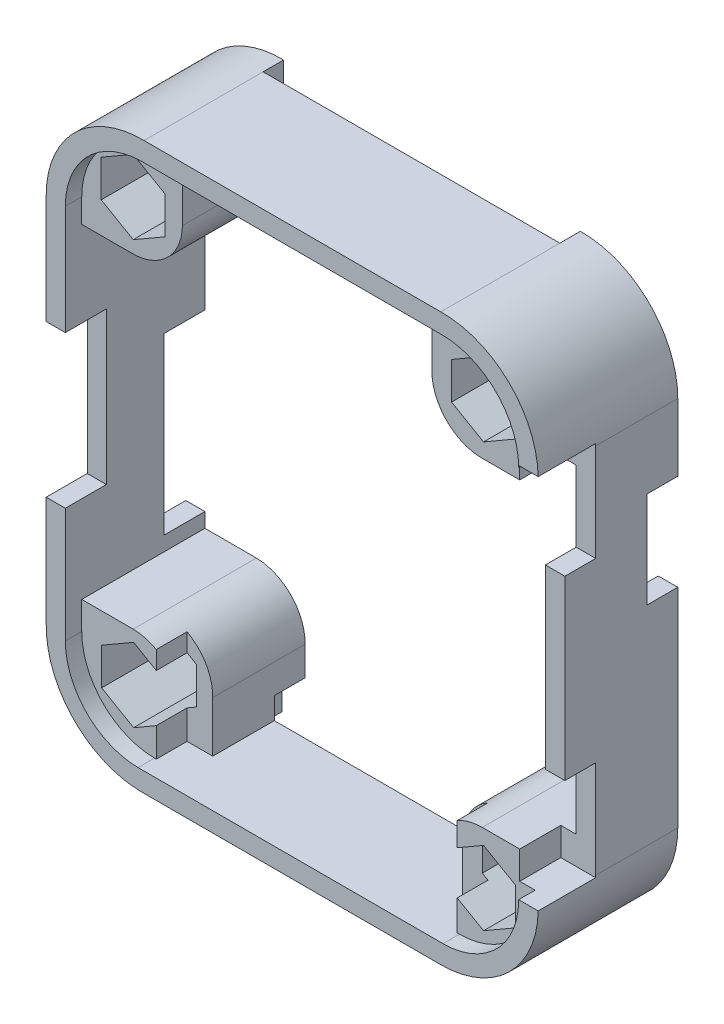
from build123d import *

# Parameters (mm, degrees)
EXTRUDE_1_DEPTH      = 12
EXTRUDE_2_DEPTH      = 12
EXTRUDE_2_2_DEPTH    = 12
EXTRUDE_2_3_DEPTH    = 12
EXTRUDE_3_DEPTH      = 13.6
MODEL_6_W            = 1.861117915
MODEL_6_H            = 16.51
CUT_EXTRUDE_1_DEPTH  = 4
MODEL_7_W            = 1.861117915
MODEL_7_H            = 14.818640087
EXTRUDE_5_DEPTH      = 16
MODEL_8_W            = 1.861117915
MODEL_8_H            = 9.9314
CUT_EXTRUDE_2_DEPTH  = 4
SKETCH_3_W           = 1.861117915
SKETCH_3_H           = 14.818640087
CUT_EXTRUDE_3_DEPTH  = 6.4
MODEL_11_W           = 1.901436907
MODEL_11_H           = 36.247223099
EXTRUDE_6_DEPTH      = 16
MODEL_12_W           = 1.901436907
MODEL_12_H           = 9.766004581
CUT_EXTRUDE_5_DEPTH  = 3
SKETCH_4_W           = 1.901436907
SKETCH_4_H           = 36.247223099
CUT_EXTRUDE_6_DEPTH  = 8
SKETCH_5_W           = 4
SKETCH_5_H           = 2.578317469
CUT_EXTRUDE_8_DEPTH  = 1.5
SKETCH_6_W           = 4
SKETCH_6_H           = 2.52224752
CUT_EXTRUDE_9_DEPTH  = 1.5
SKETCH_7_W           = 1.901436907
SKETCH_7_H           = 17.247223099
EXTRUDE_7_DEPTH      = 3
SKETCH_11_W          = 29.089002021
SKETCH_11_H          = 3
CUT_EXTRUDE_15_DEPTH = 4
SKETCH_12_W          = 28.91701862
SKETCH_12_H          = 2
CUT_EXTRUDE_16_DEPTH = 3
SKETCH_13_W          = 1
SKETCH_13_H          = 10.956361678
CUT_EXTRUDE_17_DEPTH = 3
SKETCH_14_W          = 1
SKETCH_14_H          = 13.350607955
CUT_EXTRUDE_19_DEPTH = 3
SKETCH_16_W          = 1
SKETCH_16_H          = 8.807709457
CUT_EXTRUDE_23_DEPTH = 2
SKETCH_17_W          = 1
SKETCH_17_H          = 9.756796511
CUT_EXTRUDE_24_DEPTH = 2
SKETCH_18_W          = 3
SKETCH_18_H          = 0.152653388
CUT_EXTRUDE_25_DEPTH = 1
SKETCH_20_W          = 3
SKETCH_20_H          = 10.821193865
CUT_EXTRUDE_27_DEPTH = 1
SKETCH_21_W          = 3
SKETCH_21_H          = 10.837379137
CUT_EXTRUDE_28_DEPTH = 1
SKETCH_21_2_W        = 3
SKETCH_21_2_H        = 10.837379137
CUT_EXTRUDE_29_DEPTH = 1.5
SKETCH_20_2_W        = 3
SKETCH_20_2_H        = 10.821193865
CUT_EXTRUDE_30_DEPTH = 1.5
SKETCH_22_W          = 1.861117915
SKETCH_22_H          = 4
CUT_EXTRUDE_31_DEPTH = 0.5
CUT_EXTRUDE_32_DEPTH = 0.2
CUT_EXTRUDE_33_DEPTH = 0.2
SKETCH_25_W          = 1.901436907
SKETCH_25_H          = 3
EXTRUDE_8_DEPTH      = 0.2
SKETCH_26_W          = 1.901436907
SKETCH_26_H          = 3
EXTRUDE_9_DEPTH      = 0.2


with BuildPart() as part:
    # Model → 凸台-拉伸1 (new body)
    with BuildSketch(Plane.XY):
        with BuildLine():
            Line((-5.056766423, 38.678641935), (-5.056766423, 36.349648899))
            Line((-5.056766423, 36.349648899), (-0.212608944, 36.349648899))
            ThreePointArc((-0.212608944, 36.349648899), (3.272838734, 37.712970368), (4.757065456, 41.148674369))
            Line((4.757065456, 41.148674369), (4.757065456, 46.178639116))
            Line((4.757065456, 46.178639116), (3.757607617, 46.178639116))
            Line((3.757607617, 46.178639116), (2.443231277, 46.178639116))
            ThreePointArc((2.443231277, 46.178639116), (-2.860067772, 43.981940832), (-5.056766423, 38.678641935))
        make_face()
        Polygon((-3.15877702, 42.96368598), (-0.0410845, 44.76368746), (3.07660802, 42.96368598), (3.07660802, 39.3636881), (-0.0410845, 37.56368662), (-3.15877702, 39.3636881), align=None, mode=Mode.SUBTRACT)
    extrude(amount=EXTRUDE_1_DEPTH)



with BuildPart() as body_2:
    # Model<3> → 凸台-拉伸2 (new body)
    with BuildSketch(Plane.XY):
        with BuildLine():
            Line((29.027268179, 0.031482865), (29.027268179, -5.15195259))
            Line((29.027268179, -5.15195259), (31.741581646, -5.15195259))
            ThreePointArc((31.741581646, -5.15195259), (36.960901493, -2.990035293), (39.122812995, 2.229286954))
            Line((39.122812995, 2.229286954), (39.122812995, 4.969335617))
            Line((39.122812995, 4.969335617), (33.969415054, 4.969335617))
            ThreePointArc((33.969415054, 4.969335617), (30.475678827, 3.523961372), (29.027268179, 0.031482865))
        make_face()
        Polygon((34.09651804, -3.68591338), (30.97882298, -1.8859119), (30.97882298, 1.71408598), (34.0965155, 3.51408746), (37.21420802, 1.71408598), (37.21420802, -1.8859119), align=None, mode=Mode.SUBTRACT)
    extrude(amount=EXTRUDE_2_DEPTH)


with BuildPart() as body_3:
    # Model<3> → Extrude 2 2 (new body)
    with BuildSketch(Plane.XY):
        with BuildLine():
            Line((2.033632482, -5.15195259), (4.708551083, -5.15195259))
            Line((4.708551083, -5.15195259), (4.708551083, -0.206170722))
            ThreePointArc((4.708551083, -0.206170722), (3.349197601, 3.228253817), (-0.040514857, 4.695551758))
            Line((-0.040514857, 4.695551758), (-5.056766423, 4.695551758))
            Line((-5.056766423, 4.695551758), (-5.056766423, 1.985776523))
            ThreePointArc((-5.056766423, 1.985776523), (-2.982889473, -3.044654212), (2.033632482, -5.15195259))
        make_face()
        Polygon((2.54e-06, -3.60000042), (-3.11769252, -1.7999964), (-3.11769252, 1.80000148), (0, 3.60000042), (3.11769252, 1.79999894), (3.11769252, -1.79999894), align=None, mode=Mode.SUBTRACT)
    extrude(amount=EXTRUDE_2_2_DEPTH)


with BuildPart() as body_4:
    # Model<3> → Extrude 2 3 (new body)
    with BuildSketch(Plane.XY):
        with BuildLine():
            Line((34.06287636, 36.115993727), (39.122812995, 36.115993727))
            Line((39.122812995, 36.115993727), (39.122812995, 38.694311196))
            ThreePointArc((39.122812995, 38.694311196), (36.915047022, 43.993015596), (31.607170917, 46.178639116))
            Line((31.607170917, 46.178639116), (29.06336134, 46.178639116))
            Line((29.06336134, 46.178639116), (29.06336134, 41.019064947))
            ThreePointArc((29.06336134, 41.019064947), (30.533645299, 37.517805959), (34.06287636, 36.115993727))
        make_face()
        Polygon((34.0965155, 37.56368662), (30.97882298, 39.3636881), (30.97882298, 42.96368598), (34.0965155, 44.76368746), (37.21420802, 42.96368598), (37.21420802, 39.3636881), align=None, mode=Mode.SUBTRACT)
    extrude(amount=EXTRUDE_2_3_DEPTH)


with BuildPart() as part_1:
    add(part.part)

    add(body_2.part)  # 凸台-拉伸3 merges body 2

    add(body_3.part)  # 凸台-拉伸3 merges body 3

    add(body_4.part)  # 凸台-拉伸3 merges body 4
    # Model<4> → 凸台-拉伸3 (add)
    with BuildSketch(Plane.XY):
        with BuildLine():
            ThreePointArc((31.538111903, -7.038912743), (38.245775916, -4.260535743), (41.024249902, 2.447088097))
            Line((41.024249902, 2.447088097), (41.024249902, 38.694311196))
            ThreePointArc((41.024249902, 38.694311196), (38.234155861, 45.358917184), (31.531111662, 48.055358577))
            Line((31.531111662, 48.055358577), (30.12859608, 48.055358577))
            Line((30.12859608, 48.055358577), (2.614093042, 48.055358577))
            ThreePointArc((2.614093042, 48.055358577), (-4.112474971, 45.375188878), (-6.917884338, 38.699883257))
            Line((-6.917884338, 38.699883257), (-6.917884338, 2.454230577))
            ThreePointArc((-6.917884338, 2.454230577), (-4.219356196, -4.250932902), (2.449109882, -7.038912743))
            Line((2.449109882, -7.038912743), (31.538111903, -7.038912743))
        make_face()
        with BuildLine():
            ThreePointArc((2.033632482, -5.15195259), (-2.982889473, -3.044654212), (-5.056766423, 1.985776523))
            Line((-5.056766423, 1.985776523), (-5.056766423, 38.678641935))
            ThreePointArc((-5.056766423, 38.678641935), (-2.860067772, 43.981940832), (2.443231277, 46.178639116))
            Line((2.443231277, 46.178639116), (31.607170917, 46.178639116))
            ThreePointArc((31.607170917, 46.178639116), (36.915047022, 43.993015596), (39.122812995, 38.694311196))
            Line((39.122812995, 38.694311196), (39.122812995, 2.229286954))
            ThreePointArc((39.122812995, 2.229286954), (36.960901493, -2.990035293), (31.741581646, -5.15195259))
            Line((31.741581646, -5.15195259), (2.033632482, -5.15195259))
        make_face(mode=Mode.SUBTRACT)
    extrude(amount=EXTRUDE_3_DEPTH)

    # Model<6> → 切除-拉伸1 (cut)
    with BuildSketch(Plane.XY):
        with Locations((-5.98732538, 14.8676868)):
            Rectangle(MODEL_6_W, MODEL_6_H)
    extrude(amount=CUT_EXTRUDE_1_DEPTH, mode=Mode.SUBTRACT)

    # Model<7> → 凸台-拉伸5 (add)
    with BuildSketch(Plane.XY):
        with Locations((-5.98732538, 20.600606844)):
            Rectangle(MODEL_7_W, MODEL_7_H)
    extrude(amount=EXTRUDE_5_DEPTH)

    # Model<8> → 切除-拉伸2 (cut)
    with BuildSketch(Plane.XY):
        with Locations((-5.98732538, 18.1569868)):
            Rectangle(MODEL_8_W, MODEL_8_H)
    extrude(amount=CUT_EXTRUDE_2_DEPTH, mode=Mode.SUBTRACT)

    # 草图3 → 切除-拉伸3 (cut)
    with BuildSketch(Plane.XY.offset(16)):
        with Locations((-5.98732538, 20.600606844)):
            Rectangle(SKETCH_3_W, SKETCH_3_H)
    extrude(amount=-CUT_EXTRUDE_3_DEPTH, mode=Mode.SUBTRACT)

    # Model<11> → 凸台-拉伸6 (add)
    with BuildSketch(Plane.XY):
        with Locations((40.073531449, 20.570699646)):
            Rectangle(MODEL_11_W, MODEL_11_H)
    extrude(amount=EXTRUDE_6_DEPTH)

    # Model<12> → 切除-拉伸5 (cut)
    with BuildSketch(Plane.XY):
        with Locations((40.073531449, 27.445079549)):
            Rectangle(MODEL_12_W, MODEL_12_H)
    extrude(amount=CUT_EXTRUDE_5_DEPTH, mode=Mode.SUBTRACT)

    # 草图4 → 切除-拉伸6 (cut)
    with BuildSketch(Plane.XY.offset(16)):
        with Locations((40.073531449, 20.570699646)):
            Rectangle(SKETCH_4_W, SKETCH_4_H)
    extrude(amount=-CUT_EXTRUDE_6_DEPTH, mode=Mode.SUBTRACT)

    # 草图5 → 切除-拉伸8 (cut)
    with BuildSketch(Plane(origin=(39.122812995, 0, 0), x_dir=(0, 0, -1), z_dir=(1, 0, 0))):
        with Locations((-10, 37.405152462)):
            Rectangle(SKETCH_5_W, SKETCH_5_H)
    extrude(amount=-CUT_EXTRUDE_8_DEPTH, mode=Mode.SUBTRACT)

    # 草图6 → 切除-拉伸9 (cut)
    with BuildSketch(Plane(origin=(39.122812995, 0, 0), x_dir=(0, 0, -1), z_dir=(1, 0, 0))):
        with Locations((-10, 3.708211857)):
            Rectangle(SKETCH_6_W, SKETCH_6_H)
    extrude(amount=-CUT_EXTRUDE_9_DEPTH, mode=Mode.SUBTRACT)

    # 草图7 → 凸台-拉伸7 (add)
    with BuildSketch(Plane.XY.offset(8)):
        with Locations((40.073531449, 20.570699646)):
            Rectangle(SKETCH_7_W, SKETCH_7_H)
    extrude(amount=EXTRUDE_7_DEPTH)

    # 草图11 → 切除-拉伸15 (cut)
    with BuildSketch(Plane(origin=(0, -7.038912743, 0), x_dir=(-1, 0, 0), z_dir=(0, -1, 0))):
        with Locations((-16.993610893, -1.5)):
            Rectangle(SKETCH_11_W, SKETCH_11_H)
    extrude(amount=-CUT_EXTRUDE_15_DEPTH, mode=Mode.SUBTRACT)

    # 草图12 → 切除-拉伸16 (cut)
    with BuildSketch(Plane(origin=(0, 48.055358577, 0), x_dir=(1, 0, 0), z_dir=(0, 1, 0))):
        with Locations((17.072602352, -1)):
            Rectangle(SKETCH_12_W, SKETCH_12_H)
    extrude(amount=-CUT_EXTRUDE_16_DEPTH, mode=Mode.SUBTRACT)

    # 草图13 → 切除-拉伸17 (cut)
    with BuildSketch(Plane.XY.offset(12)):
        with Locations((4.208551083, 0.326228249)):
            Rectangle(SKETCH_13_W, SKETCH_13_H)
    extrude(amount=-CUT_EXTRUDE_17_DEPTH, mode=Mode.SUBTRACT)

    # 草图14 → 切除-拉伸19 (cut)
    with BuildSketch(Plane.XY.offset(12)):
        with Locations((29.527268179, 1.523351387)):
            Rectangle(SKETCH_14_W, SKETCH_14_H)
    extrude(amount=-CUT_EXTRUDE_19_DEPTH, mode=Mode.SUBTRACT)

    # 草图16 → 切除-拉伸23 (cut)
    with BuildSketch(Plane(origin=(0, 0, 0), x_dir=(-1, 0, 0), z_dir=(0, 0, -1))):
        with Locations((-29.56336134, 40.651503848)):
            Rectangle(SKETCH_16_W, SKETCH_16_H)
    extrude(amount=-CUT_EXTRUDE_23_DEPTH, mode=Mode.SUBTRACT)

    # 草图17 → 切除-拉伸24 (cut)
    with BuildSketch(Plane(origin=(0, 0, 0), x_dir=(-1, 0, 0), z_dir=(0, 0, -1))):
        with Locations((-4.257065456, 40.176960322)):
            Rectangle(SKETCH_17_W, SKETCH_17_H)
    extrude(amount=-CUT_EXTRUDE_24_DEPTH, mode=Mode.SUBTRACT)

    # 草图18 → 切除-拉伸25 (cut)
    with BuildSketch(Plane.ZY.offset(-4.708551083)):
        with Locations((10.5, -0.129844028)):
            Rectangle(SKETCH_18_W, SKETCH_18_H)
    extrude(amount=-CUT_EXTRUDE_25_DEPTH, mode=Mode.SUBTRACT)

    # 草图20 → 切除-拉伸27 (cut)
    with BuildSketch(Plane.ZY.offset(-30.027268179)):
        with Locations((10.5, 0.258644342)):
            Rectangle(SKETCH_20_W, SKETCH_20_H)
    extrude(amount=-CUT_EXTRUDE_27_DEPTH, mode=Mode.SUBTRACT)

    # 草图21 → 切除-拉伸28 (cut)
    with BuildSketch(Plane(origin=(3.708551083, 0, 0), x_dir=(0, 0, -1), z_dir=(1, 0, 0))):
        with Locations((-10.5, 0.266736978)):
            Rectangle(SKETCH_21_W, SKETCH_21_H)
    extrude(amount=-CUT_EXTRUDE_28_DEPTH, mode=Mode.SUBTRACT)

    # 草图21<2> → 切除-拉伸29 (cut)
    with BuildSketch(Plane(origin=(3.708551083, 0, 0), x_dir=(0, 0, -1), z_dir=(1, 0, 0))):
        with Locations((-10.5, 0.266736978)):
            Rectangle(SKETCH_21_2_W, SKETCH_21_2_H)
    extrude(amount=-CUT_EXTRUDE_29_DEPTH, mode=Mode.SUBTRACT)

    # 草图20<2> → 切除-拉伸30 (cut)
    with BuildSketch(Plane.ZY.offset(-30.027268179)):
        with Locations((10.5, 0.258644342)):
            Rectangle(SKETCH_20_2_W, SKETCH_20_2_H)
    extrude(amount=-CUT_EXTRUDE_30_DEPTH, mode=Mode.SUBTRACT)

    # 草图22 → 切除-拉伸31 (cut)
    with BuildSketch(Plane(origin=(0, 6.6126868, 0), x_dir=(1, 0, 0), z_dir=(0, 1, 0))):
        with Locations((-5.98732538, -2)):
            Rectangle(SKETCH_22_W, SKETCH_22_H)
    extrude(amount=-CUT_EXTRUDE_31_DEPTH, mode=Mode.SUBTRACT)

    # 草图23 → 切除-拉伸32 (cut)
    with BuildSketch(Plane(origin=(0, 2.447088097, 0), x_dir=(1, 0, 0), z_dir=(0, 1, 0))):
        Polygon((41.024249902, -13.6), (41.024249902, -8), (37.622812995, -8), (37.622812995, -12), (39.122812995, -12), (39.122812995, -13.6), align=None)
    extrude(amount=-CUT_EXTRUDE_32_DEPTH, mode=Mode.SUBTRACT)

    # 草图24 → 切除-拉伸33 (cut)
    with BuildSketch(Plane.XZ.offset(-38.694311196)):
        Polygon((39.122812995, 13.6), (41.024249902, 13.6), (41.024249902, 8), (37.622812995, 8), (37.622812995, 12), (39.122812995, 12), align=None)
    extrude(amount=-CUT_EXTRUDE_33_DEPTH, mode=Mode.SUBTRACT)

    # 草图25 → 凸台-拉伸8 (add)
    with BuildSketch(Plane(origin=(0, 22.562077258, 0), x_dir=(1, 0, 0), z_dir=(0, 1, 0))):
        with Locations((40.073531449, -1.5)):
            Rectangle(SKETCH_25_W, SKETCH_25_H)
    extrude(amount=EXTRUDE_8_DEPTH)

    # 草图26 → 凸台-拉伸9 (add)
    with BuildSketch(Plane.XZ.offset(-32.328081839)):
        with Locations((40.073531449, 1.5)):
            Rectangle(SKETCH_26_W, SKETCH_26_H)
    extrude(amount=EXTRUDE_9_DEPTH)


solid = part_1.part
